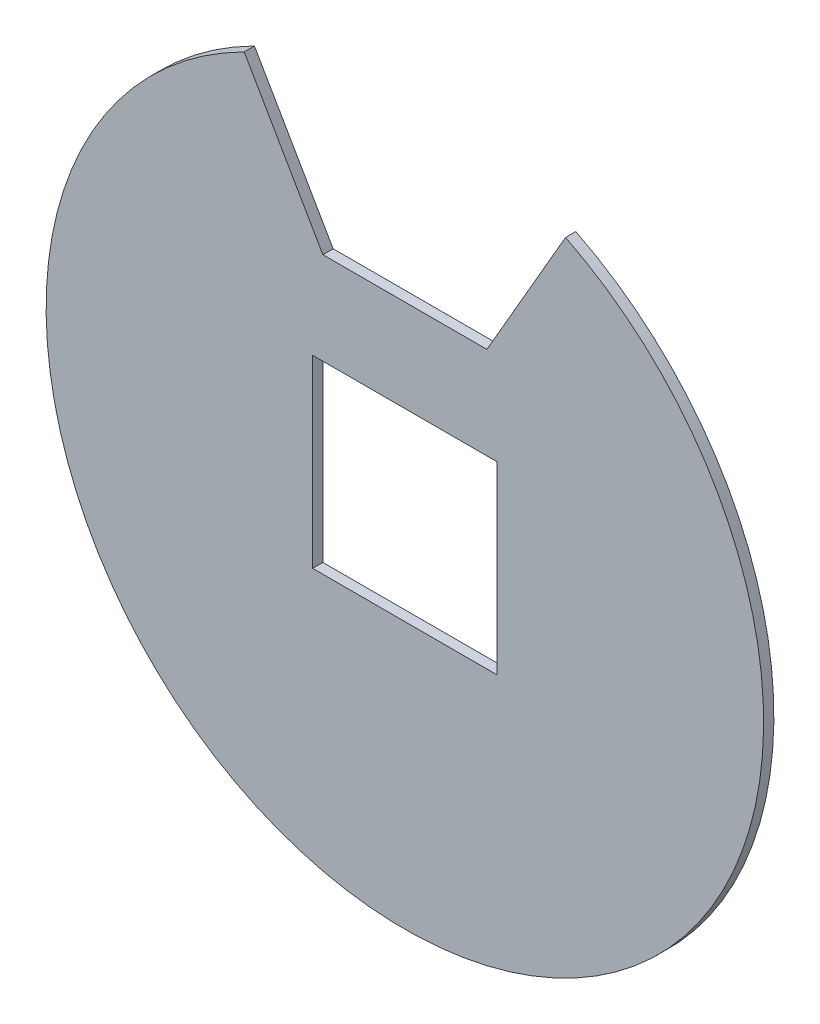
from build123d import *

# Parameters (mm, degrees)
ESQUISSE1_R             = 175
ESQUISSE1_W             = 90
ESQUISSE1_H             = 90
BOSS_EXTRU_1_DEPTH      = 5
ENL_V_MAT_EXTRU_1_DEPTH = 10


with BuildPart() as part:
    # Esquisse1 → Boss.-Extru.1 (new body)
    with BuildSketch(Plane.XY):
        Circle(ESQUISSE1_R)
        Rectangle(ESQUISSE1_W, ESQUISSE1_H, mode=Mode.SUBTRACT)
    extrude(amount=BOSS_EXTRU_1_DEPTH)

    # Esquisse2 → Enlèv. mat.-Extru.1 (cut)
    with BuildSketch(Plane.XY.offset(5)):
        with BuildLine():
            Line((78.375424383, 156.468184794), (40, 90))
            Line((40, 90), (-40, 90))
            Line((-40, 90), (-78.375424383, 156.468184794))
            ThreePointArc((-78.375424383, 156.468184794), (0, 177.468816464), (78.375424383, 156.468184794))
        make_face()
    extrude(amount=-ENL_V_MAT_EXTRU_1_DEPTH, mode=Mode.SUBTRACT)


solid = part.part
